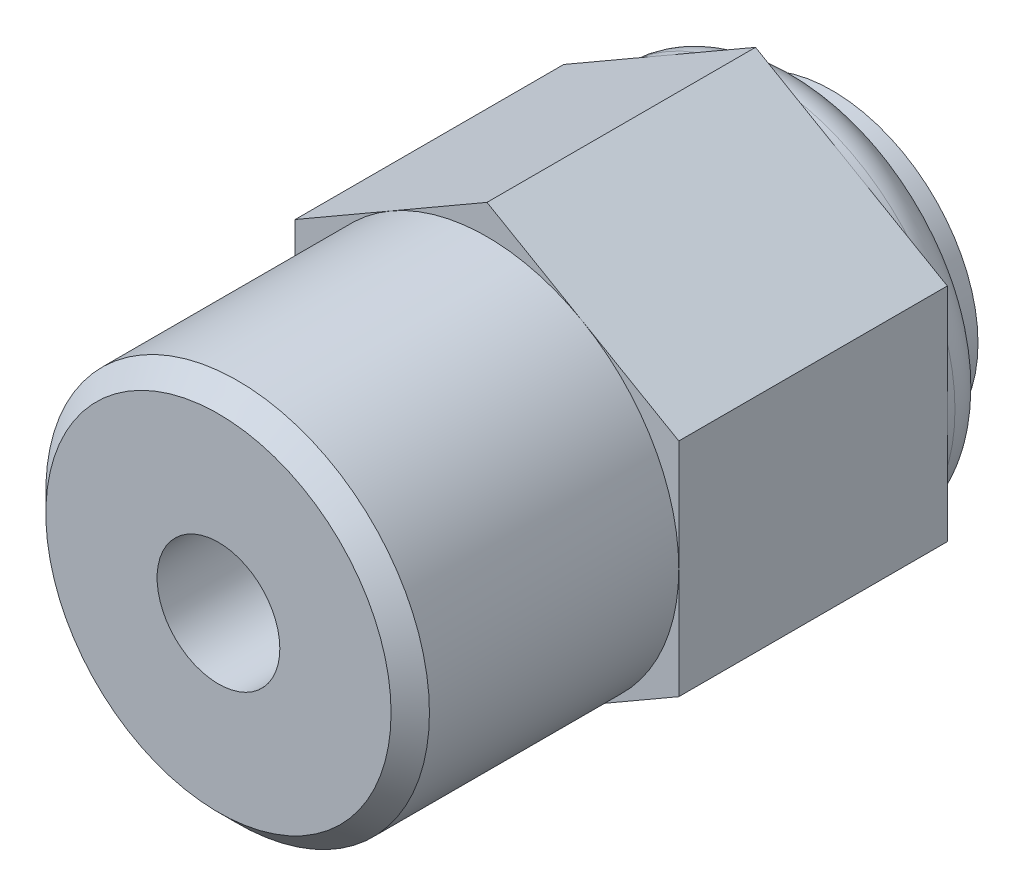
from build123d import *

# Parameters (mm, degrees)
EXTRUDE_2_DEPTH      = 7
SKETCH_1_4_R         = 5
EXTRUDE_3_DEPTH      = 1.2
EXTRUDE_START        = 14
SKETCH_1_5_R         = 5
EXTRUDE_4_DEPTH      = 14
SKETCH_1_6_R         = 4.3
EXTRUDE_5_DEPTH      = 9
SKETCH_1_8_R         = 3.8
EXTRUDE_6_DEPTH      = 2
FILLET_1_R           = 1
CUT_EXTRUDE_START    = -2
SKETCH_1_10_R        = 1.6
CUT_EXTRUDE_31_DEPTH = 18.947831619
SKETCH_1_11_R        = 3
CUT_EXTRUDE_32_DEPTH = 7
CHAMFER_1_SIZE       = 0.5


with BuildPart() as part:
    # Эскиз1 → Бобышка-Вытянуть2 (new body)
    with BuildSketch(Plane.XY):
        Polygon((0, 5.773502692), (-5, 2.886751346), (-5, -2.886751346), (0, -5.773502692), (5, -2.886751346), (5, 2.886751346), align=None)
    extrude(amount=EXTRUDE_2_DEPTH)

    # Эскиз1<4> → Бобышка-Вытянуть3 (add)
    with BuildSketch(Plane.XY):
        Circle(SKETCH_1_4_R)
    extrude(amount=-EXTRUDE_3_DEPTH)

    # Эскиз1<5> → Бобышка-Вытянуть4 (add)
    with BuildSketch(Plane.XY.offset(EXTRUDE_START)):
        Circle(SKETCH_1_5_R)
    extrude(amount=-EXTRUDE_4_DEPTH)

    # Эскиз1<6> → Бобышка-Вытянуть5 (add)
    with BuildSketch(Plane.XY):
        Circle(SKETCH_1_6_R)
    extrude(amount=EXTRUDE_5_DEPTH)

    # Эскиз1<8> → Бобышка-Вытянуть6 (add)
    with BuildSketch(Plane.XY):
        Circle(SKETCH_1_8_R)
    extrude(amount=-EXTRUDE_6_DEPTH)

    # Скругление1
    fillet_1_edges = [part.edges().sort_by_distance(p)[0] for p in [
        (-5, 0, -1.2),
    ]]
    fillet(fillet_1_edges, radius=FILLET_1_R)

    # Эскиз1<10> → Вырез-Вытянуть31 (cut, through all)
    with BuildSketch(Plane.XY.offset(CUT_EXTRUDE_START)):
        Circle(SKETCH_1_10_R)
    extrude(amount=CUT_EXTRUDE_31_DEPTH, mode=Mode.SUBTRACT)

    # Эскиз1<11> → Вырез-Вытянуть32 (cut)
    with BuildSketch(Plane.XY.offset(CUT_EXTRUDE_START)):
        Circle(SKETCH_1_11_R)
    extrude(amount=CUT_EXTRUDE_32_DEPTH, mode=Mode.SUBTRACT)

    # Фаска1
    chamfer_1_edges = [part.edges().sort_by_distance(p)[0] for p in [
        (-5, 0, 14),
    ]]
    chamfer(chamfer_1_edges, length=CHAMFER_1_SIZE)


solid = part.part
